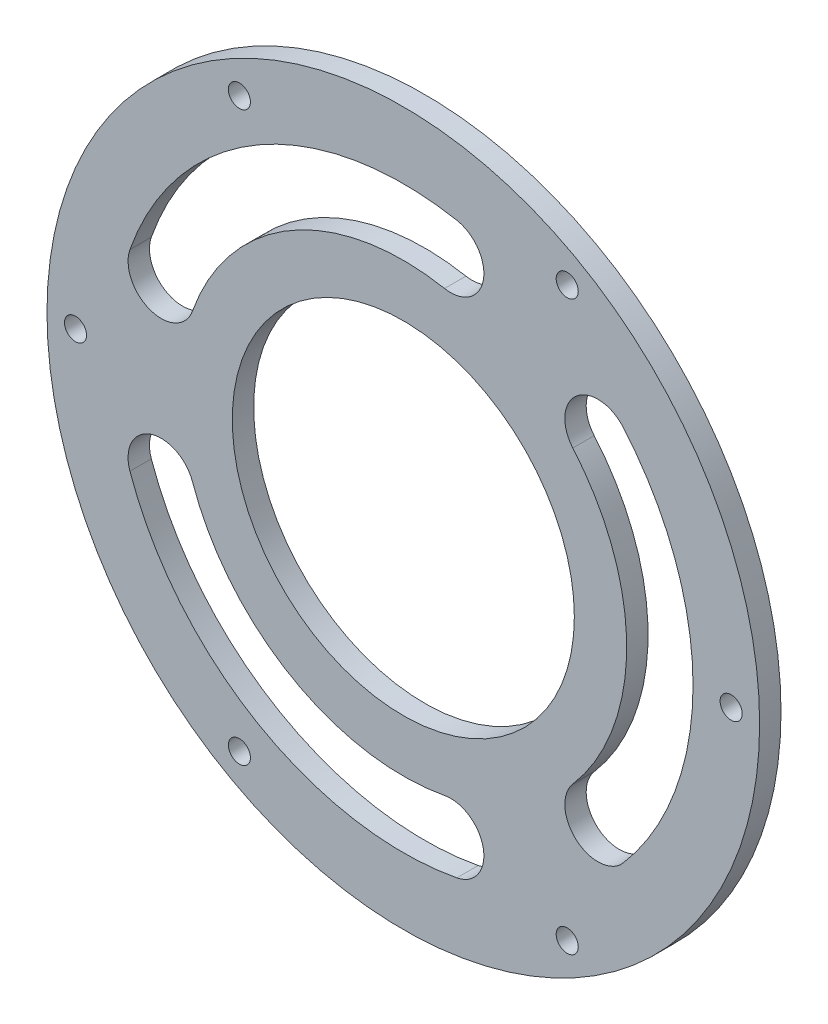
from build123d import *

# Parameters (mm, degrees)
SKETCH_1_R          = 52
SKETCH_1_R_2        = 1.55
SKETCH_1_R_3        = 40
EXTRUDE_1_DEPTH     = 3
EXTRUDE_START       = -3
SKETCH_2_R          = 40
SKETCH_2_R_2        = 24
EXTRUDE_2_DEPTH     = 3
CUT_EXTRUDE_1_DEPTH = 10
SKETCH_5_R          = 63.024090269
SKETCH_5_R_2        = 50
CUT_EXTRUDE_2_DEPTH = 10


with BuildPart() as part:
    # 草图1 → 凸台-拉伸1 (new body)
    with BuildSketch(Plane.XY):
        Circle(SKETCH_1_R)
        with Locations((46, 0)):
            Circle(SKETCH_1_R_2, mode=Mode.SUBTRACT)
        with Locations((23, -39.837168574)):
            Circle(SKETCH_1_R_2, mode=Mode.SUBTRACT)
        with Locations((-23, -39.837168574)):
            Circle(SKETCH_1_R_2, mode=Mode.SUBTRACT)
        with Locations((-46, 0)):
            Circle(SKETCH_1_R_2, mode=Mode.SUBTRACT)
        with Locations((-23, 39.837168574)):
            Circle(SKETCH_1_R_2, mode=Mode.SUBTRACT)
        with Locations((23, 39.837168574)):
            Circle(SKETCH_1_R_2, mode=Mode.SUBTRACT)
        Circle(SKETCH_1_R_3, mode=Mode.SUBTRACT)
    extrude(amount=EXTRUDE_1_DEPTH)

    # 草图2 → 凸台-拉伸2 (add)
    with BuildSketch(Plane.XY.offset(3).offset(EXTRUDE_START)):
        Circle(SKETCH_2_R)
        Circle(SKETCH_2_R_2, mode=Mode.SUBTRACT)
    extrude(amount=EXTRUDE_2_DEPTH)

    # 草图4 → 切除-拉伸1 (cut)
    with BuildSketch(Plane(origin=(0, 0, 0), x_dir=(-1, 0, 0), z_dir=(0, 0, -1))):
        with BuildLine():
            ThreePointArc((38.356187762, 13.472205401), (20.326690938, 35.206861455), (-7.510821758, 39.953535695))
            ThreePointArc((-7.510821758, 39.953535695), (-11.224371039, 34.520536752), (-5.791372097, 30.806987471))
            ThreePointArc((-5.791372097, 30.806987471), (15.673309062, 27.146967618), (29.575319812, 10.388018377))
            ThreePointArc((29.575319812, 10.388018377), (35.507847299, 7.539677914), (38.356187762, 13.472205401))
        make_face()
        with BuildLine():
            ThreePointArc((-5.791372097, -30.806987471), (15.673309062, -27.146967618), (29.575319812, -10.388018377))
            ThreePointArc((29.575319812, -10.388018377), (35.507847299, -7.539677914), (38.356187762, -13.472205401))
            ThreePointArc((38.356187762, -13.472205401), (20.326690938, -35.206861455), (-7.510821758, -39.953535695))
            ThreePointArc((-7.510821758, -39.953535695), (-11.224371039, -34.520536752), (-5.791372097, -30.806987471))
        make_face()
        with BuildLine():
            ThreePointArc((-23.783947715, 20.418969094), (-31.346618124, 0), (-23.783947715, -20.418969094))
            ThreePointArc((-23.783947715, -20.418969094), (-24.28347626, -26.980858838), (-30.845366003, -26.481330293))
            ThreePointArc((-30.845366003, -26.481330293), (-40.653381876, 0), (-30.845366003, 26.481330293))
            ThreePointArc((-30.845366003, 26.481330293), (-24.28347626, 26.980858838), (-23.783947715, 20.418969094))
        make_face()
    extrude(amount=-CUT_EXTRUDE_1_DEPTH, mode=Mode.SUBTRACT)

    # 草图5 → 切除-拉伸2 (cut)
    with BuildSketch(Plane(origin=(0, 0, 0), x_dir=(-1, 0, 0), z_dir=(0, 0, -1))):
        Circle(SKETCH_5_R)
        Circle(SKETCH_5_R_2, mode=Mode.SUBTRACT)
    extrude(amount=-CUT_EXTRUDE_2_DEPTH, mode=Mode.SUBTRACT)


solid = part.part
